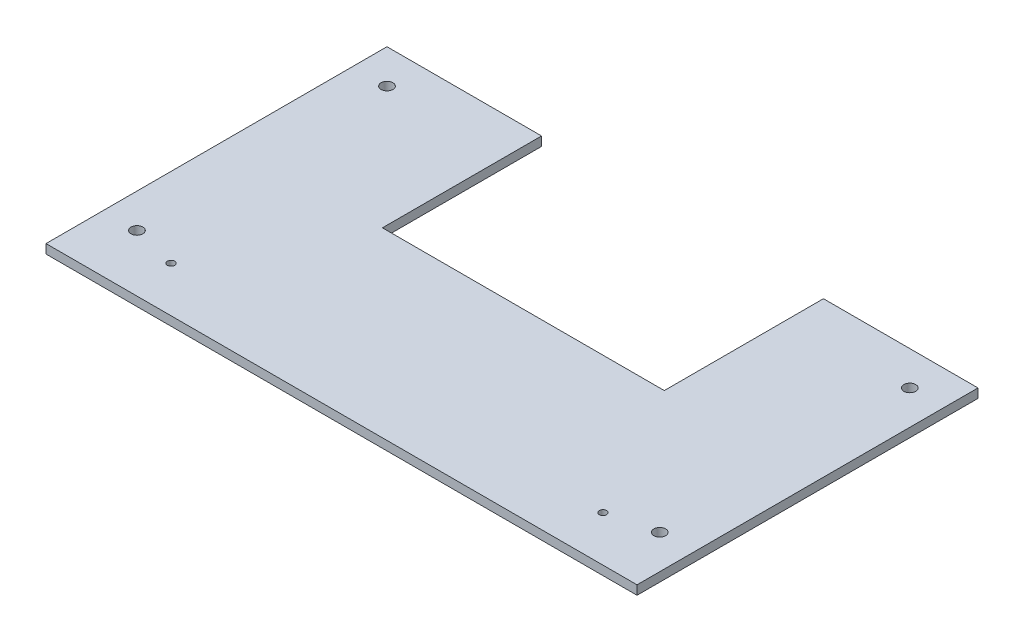
from build123d import *

# Parameters (mm, degrees)
CROQUIS1_W              = 260
CROQUIS1_H              = 150
SALIENTE_EXTRUIR1_DEPTH = 4
CROQUIS2_R              = 2.6
CROQUIS2_W              = 124
CROQUIS2_H              = 70
CORTAR_EXTRUIR1_DEPTH   = 4
CROQUIS3_R              = 1.6
CORTAR_EXTRUIR2_DEPTH   = 10


with BuildPart() as part:
    # Croquis1 → Saliente-Extruir1 (new body)
    with BuildSketch(Plane(origin=(0, 0, 0), x_dir=(1, 0, 0), z_dir=(0, 1, 0))):
        Rectangle(CROQUIS1_W, CROQUIS1_H)
    extrude(amount=SALIENTE_EXTRUIR1_DEPTH)

    # Croquis2 → Cortar-Extruir1 (cut)
    with BuildSketch(Plane(origin=(0, 4, 0), x_dir=(1, 0, 0), z_dir=(0, 1, 0))):
        with Locations(Location((-115, 60, 0), (0, 0, 270))):
            Circle(CROQUIS2_R)
        with Locations(Location((115, 60, 0), (0, 0, 270))):
            Circle(CROQUIS2_R)
        with Locations(Location((115, -50, 0), (0, 0, 270))):
            Circle(CROQUIS2_R)
        with Locations(Location((-115, -50, 0), (0, 0, 270))):
            Circle(CROQUIS2_R)
        with Locations((0, 40)):
            Rectangle(CROQUIS2_W, CROQUIS2_H)
    extrude(amount=-CORTAR_EXTRUIR1_DEPTH, mode=Mode.SUBTRACT)

    # Croquis3 → Cortar-Extruir2 (cut)
    with BuildSketch(Plane(origin=(0, 4, 0), x_dir=(1, 0, 0), z_dir=(0, 1, 0))):
        with Locations(Location((95, -55, 0), (0, 0, 270))):
            Circle(CROQUIS3_R)
        with Locations(Location((-95, -55, 0), (0, 0, 270))):
            Circle(CROQUIS3_R)
    extrude(amount=-CORTAR_EXTRUIR2_DEPTH, mode=Mode.SUBTRACT)


solid = part.part
